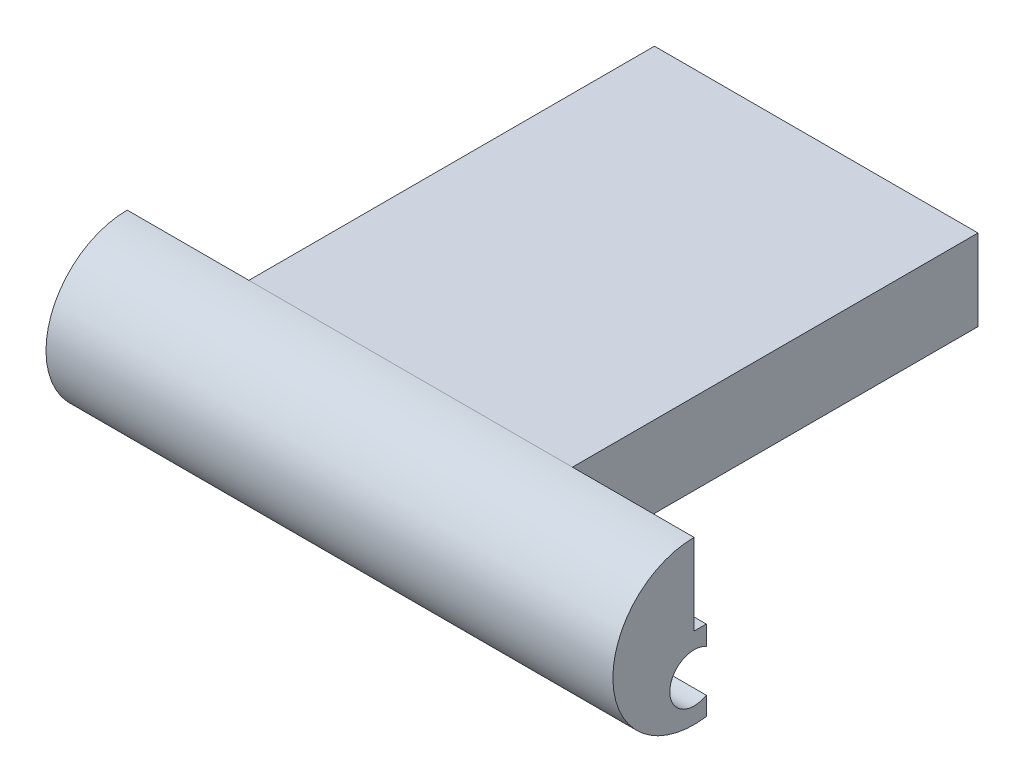
from build123d import *

# Parameters (mm, degrees)
SKETCH1_W           = 398.88
SKETCH1_H           = 100
BOSS_EXTRUDE1_DEPTH = 500
BOSS_EXTRUDE2_DEPTH = 698.88


with BuildPart() as part:
    # Sketch1 → Boss-Extrude1 (new body)
    with BuildSketch(Plane.XY):
        with Locations((-24.459622642, 226.581886792)):
            Rectangle(SKETCH1_W, SKETCH1_H)
    extrude(amount=BOSS_EXTRUDE1_DEPTH)

    # Sketch2 → Boss-Extrude2 (add)
    with BuildSketch(Plane.ZY.offset(373.899622642)):
        with BuildLine():
            Line((500, 276.581886792), (500, 176.581886792))
            Line((500, 176.581886792), (485, 176.581886792))
            Line((485, 176.581886792), (485, 152.581886792))
            ThreePointArc((485, 152.581886792), (530.001319942, 126.601886792), (485, 100.621886792))
            Line((485, 100.621886792), (485, 77.731886792))
            ThreePointArc((485, 77.731886792), (599.838299174, 169.059957008), (500, 276.581886792))
        make_face()
    extrude(amount=-BOSS_EXTRUDE2_DEPTH)


solid = part.part
